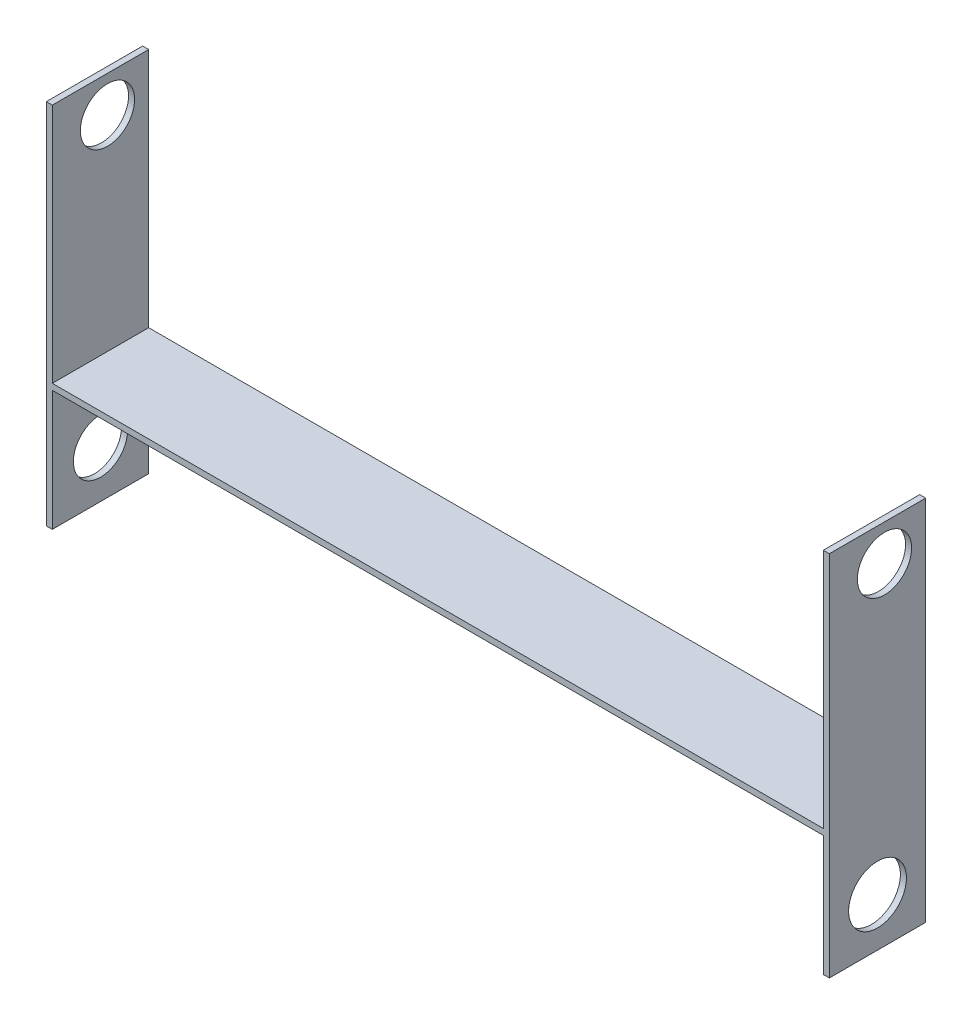
from build123d import *

# Parameters (mm, degrees)
BOSS_EXTRUDE1_DEPTH = 50.8
SKETCH3_W           = 50.8
SKETCH3_H           = 63.5
SKETCH3_R           = 14.2875
BOSS_EXTRUDE2_DEPTH = 3.175
SKETCH4_W           = 50.8
SKETCH4_H           = 63.5
SKETCH4_R           = 15.24
BOSS_EXTRUDE3_DEPTH = 3.175
SKETCH5_R           = 14.2875
CUT_EXTRUDE1_DEPTH  = 508


with BuildPart() as part:
    # Sketch2 → Boss-Extrude1 (new body)
    with BuildSketch(Plane.XY):
        Polygon((0, 0), (0, 130.175), (-3.175, 130.175), (-3.175, 3.175), (-409.575, 3.175), (-409.575, 130.175), (-412.75, 130.175), (-412.75, 0), align=None)
    extrude(amount=BOSS_EXTRUDE1_DEPTH)

    # Sketch3 → Boss-Extrude2 (add)
    with BuildSketch(Plane.ZY.offset(412.75)):
        with Locations((25.4, -31.75)):
            Rectangle(SKETCH3_W, SKETCH3_H)
        with Locations((25.4, -38.1)):
            Circle(SKETCH3_R, mode=Mode.SUBTRACT)
    extrude(amount=-BOSS_EXTRUDE2_DEPTH)

    # Sketch4 → Boss-Extrude3 (add)
    with BuildSketch(Plane(origin=(0, 0, 0), x_dir=(0, 0, -1), z_dir=(1, 0, 0))):
        with Locations((-25.4, -31.75)):
            Rectangle(SKETCH4_W, SKETCH4_H)
        with Locations((-25.4, -38.1)):
            Circle(SKETCH4_R, mode=Mode.SUBTRACT)
    extrude(amount=-BOSS_EXTRUDE3_DEPTH)

    # Sketch5 → Cut-Extrude1 (cut)
    with BuildSketch(Plane(origin=(0, 0, 0), x_dir=(0, 0, -1), z_dir=(1, 0, 0))):
        with Locations((-21.7297, 111.125)):
            Circle(SKETCH5_R)
    extrude(amount=-CUT_EXTRUDE1_DEPTH, mode=Mode.SUBTRACT)


solid = part.part
